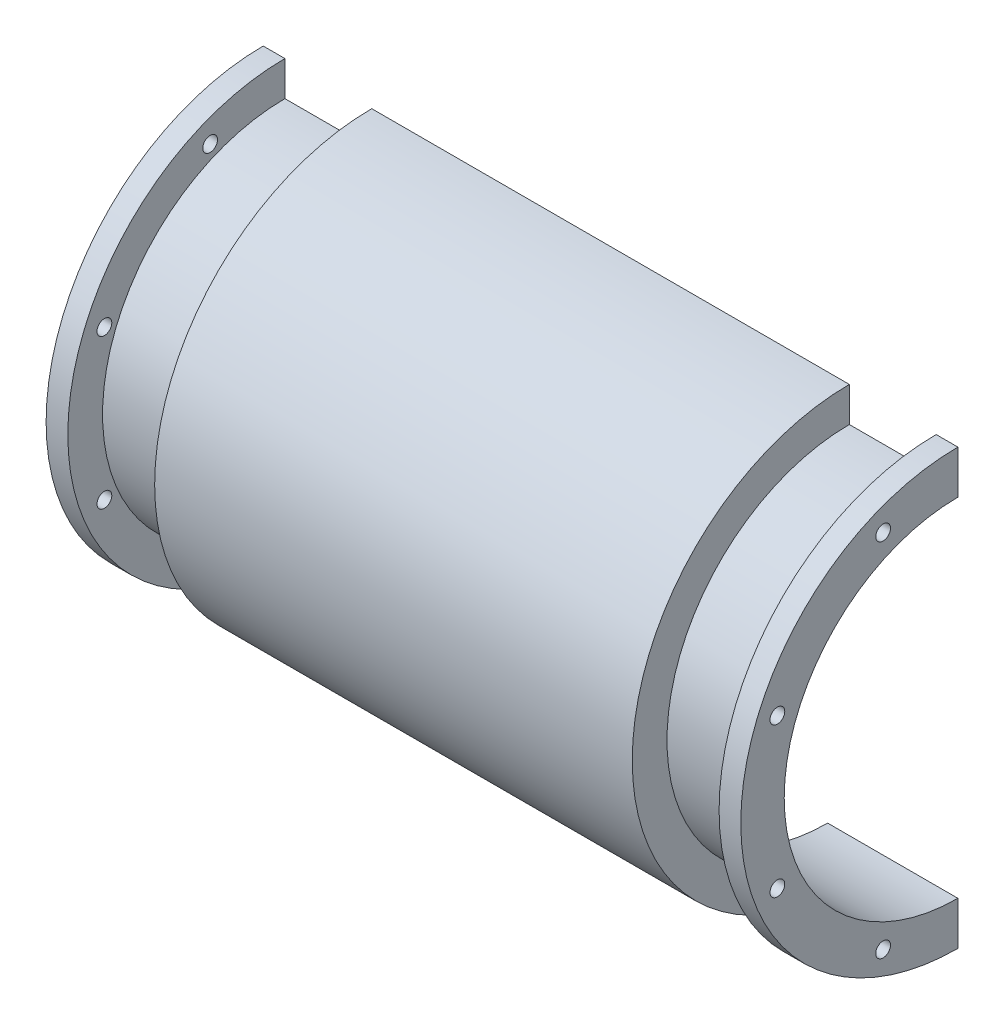
from build123d import *

# Parameters (mm, degrees)
REVOLVE_1_ANGLE          = 180
HOLE_WIZARD_M3_1_D       = 3.4
HOLE_WIZARD_M3_1_DEPTH   = 5
PATTERN_CIRCULAR_1_COUNT = 4
PATTERN_CIRCULAR_1_ANGLE = 135
MIRROR_1_COPY_1_D        = 3.4
MIRROR_1_COPY_1_DEPTH    = 5
MIRROR_1_COPY_2_D        = 3.4
MIRROR_1_COPY_2_DEPTH    = 5
MIRROR_1_COPY_3_D        = 3.4
MIRROR_1_COPY_3_DEPTH    = 5


with BuildPart() as part:
    # ｽｹｯﾁ1 → 回転1 (revolve)
    with BuildSketch(Plane.XY):
        Polygon((-80, 40), (-50, 40), (-50, 49), (50, 49), (50, 40), (80, 40), (80, 50), (75, 50), (75, 42), (55, 42), (55, 50), (-55, 50), (-55, 42), (-75, 42), (-75, 50), (-80, 50), align=None)
    revolve(axis=Axis((-50, 0, 0), (1, 0, 0)), revolution_arc=REVOLVE_1_ANGLE)

    # M3 すきま穴1
    with Locations(Plane.ZY.offset(80)):
        with Locations((17.220754456, -41.574578963)):
            hole_wizard_m3_1 = Hole(HOLE_WIZARD_M3_1_D / 2, depth=HOLE_WIZARD_M3_1_DEPTH)

    # 円形ﾊﾟﾀｰﾝ1: M3 すきま穴1 ×4 about axis
    pattern_circular_1_axis = Axis((0, 0, 0), (-1, 0, 0))
    for i in range(1, PATTERN_CIRCULAR_1_COUNT):
        add(hole_wizard_m3_1.rotate(pattern_circular_1_axis, i * PATTERN_CIRCULAR_1_ANGLE / (PATTERN_CIRCULAR_1_COUNT - 1)), mode=Mode.SUBTRACT)

    # ﾐﾗｰ1: M3 すきま穴1 across plane
    add(hole_wizard_m3_1.mirror(Plane(origin=(0, 0, 0), x_dir=(0, 0, 1), z_dir=(1, 0, 0))), mode=Mode.SUBTRACT)

    # ﾐﾗｰ1 copy 1
    with Locations(Plane(origin=(80, 0, 0), x_dir=(0, 0.7071067811865487, 0.7071067811865464), z_dir=(1, 0, 0))):
        with Locations((17.220754456, 41.574578963)):
            Hole(MIRROR_1_COPY_1_D / 2, depth=MIRROR_1_COPY_1_DEPTH)

    # ﾐﾗｰ1 copy 2
    with Locations(Plane.YZ.offset(80)):
        with Locations((17.220754456, 41.574578963)):
            Hole(MIRROR_1_COPY_2_D / 2, depth=MIRROR_1_COPY_2_DEPTH)

    # ﾐﾗｰ1 copy 3
    with Locations(Plane(origin=(80, 0, 0), x_dir=(0, 0.7071067811865441, -0.7071067811865509), z_dir=(1, 0, 0))):
        with Locations((17.220754456, 41.574578963)):
            Hole(MIRROR_1_COPY_3_D / 2, depth=MIRROR_1_COPY_3_DEPTH)


solid = part.part
